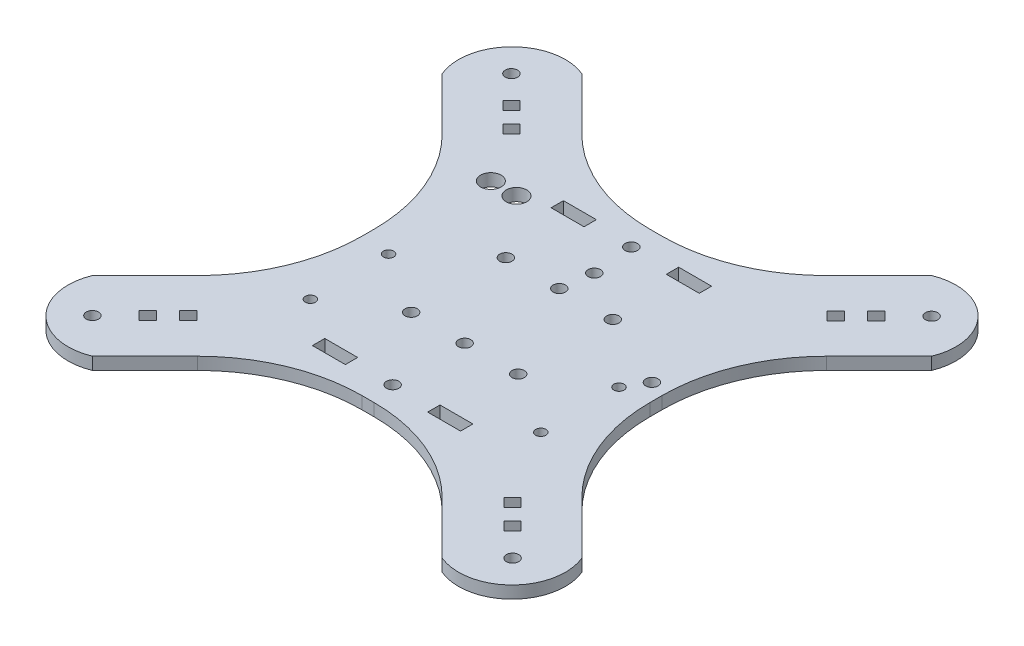
from build123d import *

# Parameters (mm, degrees)
ESBO_O1_R                = 1.5
ESBO_O1_R_2              = 1.25
ESBO_O1_R_3              = 2.5
ESBO_O1_W                = 8
ESBO_O1_H                = 3
RESSALTO_EXTRUS_O1_DEPTH = 3


with BuildPart() as part:
    # Esboço1 → Ressalto-extrusão1 (new body)
    with BuildSketch(Plane(origin=(0, 0, 0), x_dir=(1, 0, 0), z_dir=(0, 1, 0))):
        with BuildLine():
            Line((52.381074728, 40.494515949), (65.131240604, 27.744350072))
            ThreePointArc((65.131240604, 27.744350072), (73.802150657, 14.76741612), (76.846969357, -0.539921175))
            Line((76.846969357, -0.539921175), (76.846969357, -3.460078825))
            ThreePointArc((76.846969357, -3.460078825), (73.802150657, -18.76741612), (65.131240604, -31.744350072))
            Line((65.131240604, -31.744350072), (52.381074728, -44.494515949))
            ThreePointArc((52.381074728, -44.494515949), (55.208930541, -58.638038816), (69.352453408, -61.465894629))
            Line((69.352453408, -61.465894629), (82.102619284, -48.715728753))
            ThreePointArc((82.102619284, -48.715728753), (95.079553237, -40.0448187), (110.386890532, -37))
            Line((110.386890532, -37), (113.308680045, -37))
            ThreePointArc((113.308680045, -37), (128.61601734, -40.0448187), (141.592951292, -48.715728753))
            Line((141.592951292, -48.715728753), (154.343117169, -61.465894629))
            ThreePointArc((154.343117169, -61.465894629), (168.486640036, -58.638038816), (171.314495849, -44.494515949))
            Line((171.314495849, -44.494515949), (158.564329973, -31.744350072))
            ThreePointArc((158.564329973, -31.744350072), (149.89341992, -18.76741612), (146.84860122, -3.460078825))
            Line((146.84860122, -3.460078825), (146.84860122, -0.539921175))
            ThreePointArc((146.84860122, -0.539921175), (149.89341992, 14.76741612), (158.564329973, 27.744350072))
            Line((158.564329973, 27.744350072), (171.314495849, 40.494515949))
            ThreePointArc((171.314495849, 40.494515949), (168.486640036, 54.638038816), (154.343117169, 57.465894629))
            Line((154.343117169, 57.465894629), (141.592951292, 44.715728753))
            ThreePointArc((141.592951292, 44.715728753), (128.61601734, 36.0448187), (113.308680045, 33))
            Line((113.308680045, 33), (110.386890532, 33))
            ThreePointArc((110.386890532, 33), (95.079553237, 36.0448187), (82.102619284, 44.715728753))
            Line((82.102619284, 44.715728753), (69.352453408, 57.465894629))
            ThreePointArc((69.352453408, 57.465894629), (55.208930541, 54.638038816), (52.381074728, 40.494515949))
        make_face()
        with Locations(Location((111.847785288, 27, 0), (0, 0, 270))):
            Circle(ESBO_O1_R, mode=Mode.SUBTRACT)
        with Locations(Location((111.847785288, -31, 0), (0, 0, 270))):
            Circle(ESBO_O1_R, mode=Mode.SUBTRACT)
        with Locations(Location((60.796461355, 48.909902577, 0), (0, 0, 270))):
            Circle(ESBO_O1_R, mode=Mode.SUBTRACT)
        with Locations(Location((111.847785288, -13.5, 0), (0, 0, 270))):
            Circle(ESBO_O1_R, mode=Mode.SUBTRACT)
        with Locations(Location((124.847785288, -13.5, 0), (0, 0, 270))):
            Circle(ESBO_O1_R, mode=Mode.SUBTRACT)
        with Locations(Location((98.847785288, -13.5, 0), (0, 0, 270))):
            Circle(ESBO_O1_R, mode=Mode.SUBTRACT)
        with Locations(Location((98.847785288, 9.5, 0), (0, 0, 270))):
            Circle(ESBO_O1_R, mode=Mode.SUBTRACT)
        with Locations(Location((124.847785288, 9.5, 0), (0, 0, 270))):
            Circle(ESBO_O1_R, mode=Mode.SUBTRACT)
        with Locations(Location((111.847785288, 9.5, 0), (0, 0, 270))):
            Circle(ESBO_O1_R, mode=Mode.SUBTRACT)
        with Locations(Location((83.847785288, -4, 0), (0, 0, 270))):
            Circle(ESBO_O1_R_2, mode=Mode.SUBTRACT)
        with Locations(Location((139.847785288, -4, 0), (0, 0, 270))):
            Circle(ESBO_O1_R_2, mode=Mode.SUBTRACT)
        with Locations(Location((60.796461355, -52.909902577, 0), (0, 0, 270))):
            Circle(ESBO_O1_R, mode=Mode.SUBTRACT)
        with Locations(Location((139.847785288, -23, 0), (0, 0, 270))):
            Circle(ESBO_O1_R_2, mode=Mode.SUBTRACT)
        with Locations(Location((83.847785288, -23, 0), (0, 0, 270))):
            Circle(ESBO_O1_R_2, mode=Mode.SUBTRACT)
        with Locations(Location((112.847785288, 17, 0), (0, 0, 270))):
            Circle(ESBO_O1_R, mode=Mode.SUBTRACT)
        with Locations(Location((162.899109221, -52.909902577, 0), (0, 0, 270))):
            Circle(ESBO_O1_R, mode=Mode.SUBTRACT)
        with Locations(Location((162.899109221, 48.909902577, 0), (0, 0, 270))):
            Circle(ESBO_O1_R, mode=Mode.SUBTRACT)
        with Locations(Location((142.847785288, 1, 0), (0, 0, 270))):
            Circle(ESBO_O1_R, mode=Mode.SUBTRACT)
        with Locations(Location((80.903069614, 23.804170545, 0), (0, 0, 270))):
            Circle(ESBO_O1_R_3, mode=Mode.SUBTRACT)
        with Locations(Location((87.129249486, 23.804170545, 0), (0, 0, 270))):
            Circle(ESBO_O1_R_3, mode=Mode.SUBTRACT)
        with Locations((125.847785288, -31)):
            Rectangle(ESBO_O1_W, ESBO_O1_H, mode=Mode.SUBTRACT)
        Polygon((149.102405747, 37.250212448), (151.223726091, 39.371532792), (153.345046434, 37.250212448), (151.223726091, 35.128892104), align=None, mode=Mode.SUBTRACT)
        Polygon((154.052153215, 42.199959916), (156.173473559, 44.32128026), (158.294793903, 42.199959916), (156.173473559, 40.078639573), align=None, mode=Mode.SUBTRACT)
        with Locations((97.847785288, -31)):
            Rectangle(ESBO_O1_W, ESBO_O1_H, mode=Mode.SUBTRACT)
        with Locations((97.847785288, 27)):
            Rectangle(ESBO_O1_W, ESBO_O1_H, mode=Mode.SUBTRACT)
        with Locations((125.847785288, 27)):
            Rectangle(ESBO_O1_W, ESBO_O1_H, mode=Mode.SUBTRACT)
        Polygon((67.522097018, 44.32128026), (65.400776674, 42.199959916), (67.522097018, 40.078639573), (69.643417361, 42.199959916), align=None, mode=Mode.SUBTRACT)
        Polygon((72.471844486, 39.371532792), (70.350524142, 37.250212448), (72.471844486, 35.128892104), (74.593164829, 37.250212448), align=None, mode=Mode.SUBTRACT)
        Polygon((67.522097018, -44.078639573), (65.400776674, -46.199959916), (67.522097018, -48.32128026), (69.643417361, -46.199959916), align=None, mode=Mode.SUBTRACT)
        Polygon((74.593164829, -41.250212448), (72.471844486, -43.371532792), (70.350524142, -41.250212448), (72.471844486, -39.128892104), align=None, mode=Mode.SUBTRACT)
        Polygon((156.173473559, -48.32128026), (158.294793903, -46.199959916), (156.173473559, -44.078639573), (154.052153215, -46.199959916), align=None, mode=Mode.SUBTRACT)
        Polygon((151.223726091, -43.371532792), (153.345046434, -41.250212448), (151.223726091, -39.128892104), (149.102405747, -41.250212448), align=None, mode=Mode.SUBTRACT)
    extrude(amount=RESSALTO_EXTRUS_O1_DEPTH)


solid = part.part
